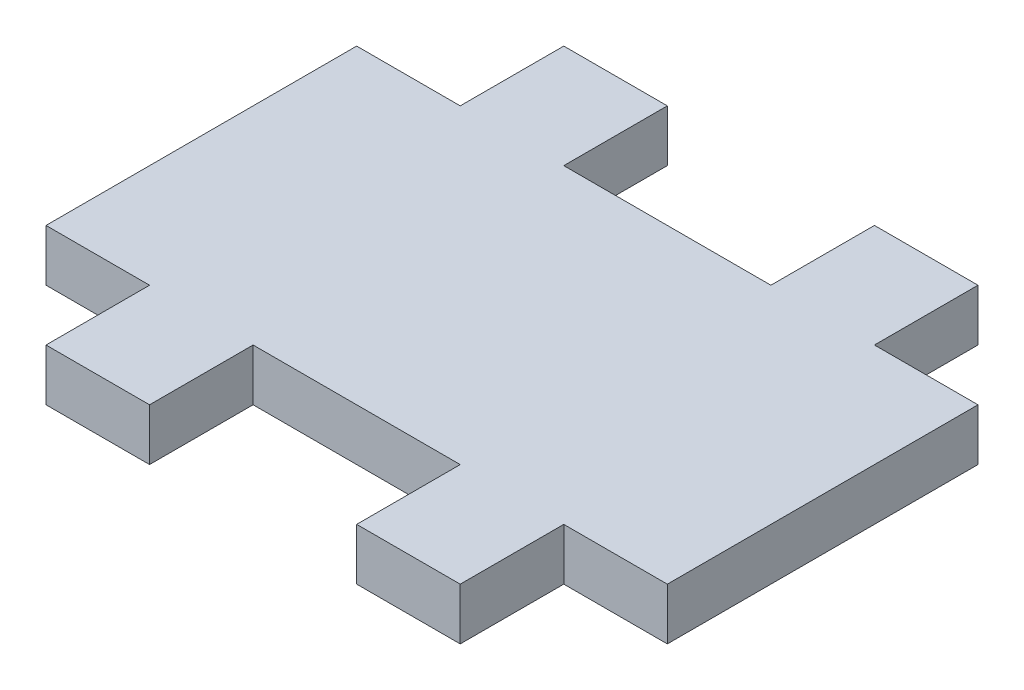
from build123d import *

# Parameters (mm, degrees)
SKETCH1_W           = 38.1
SKETCH1_H           = 3.175
BOSS_EXTRUDE1_DEPTH = 31.75
SKETCH2_W           = 6.35
SKETCH2_H           = 6.35
SKETCH2_W_2         = 12.7
CUT_EXTRUDE1_DEPTH  = 104.656480846


with BuildPart() as part:
    # Sketch1 → Boss-Extrude1 (new body)
    with BuildSketch(Plane.XY):
        with Locations((-79.573135706, 252.60008846)):
            Rectangle(SKETCH1_W, SKETCH1_H)
    extrude(amount=-BOSS_EXTRUDE1_DEPTH)

    # Sketch2 → Cut-Extrude1 (cut, through all)
    with BuildSketch(Plane(origin=(0, 254.18758846, 0), x_dir=(1, 0, 0), z_dir=(0, 1, 0))):
        with Locations((-95.448135706, 28.575)):
            Rectangle(SKETCH2_W, SKETCH2_H)
        with Locations((-79.573135706, 28.575)):
            Rectangle(SKETCH2_W_2, SKETCH2_H)
        with Locations((-63.698135706, 28.575)):
            Rectangle(SKETCH2_W, SKETCH2_H)
        with Locations((-95.448135706, 3.175)):
            Rectangle(SKETCH2_W, SKETCH2_H)
        with Locations((-79.573135706, 3.175)):
            Rectangle(SKETCH2_W_2, SKETCH2_H)
        with Locations((-63.698135706, 3.175)):
            Rectangle(SKETCH2_W, SKETCH2_H)
    extrude(amount=-CUT_EXTRUDE1_DEPTH, mode=Mode.SUBTRACT)


solid = part.part
